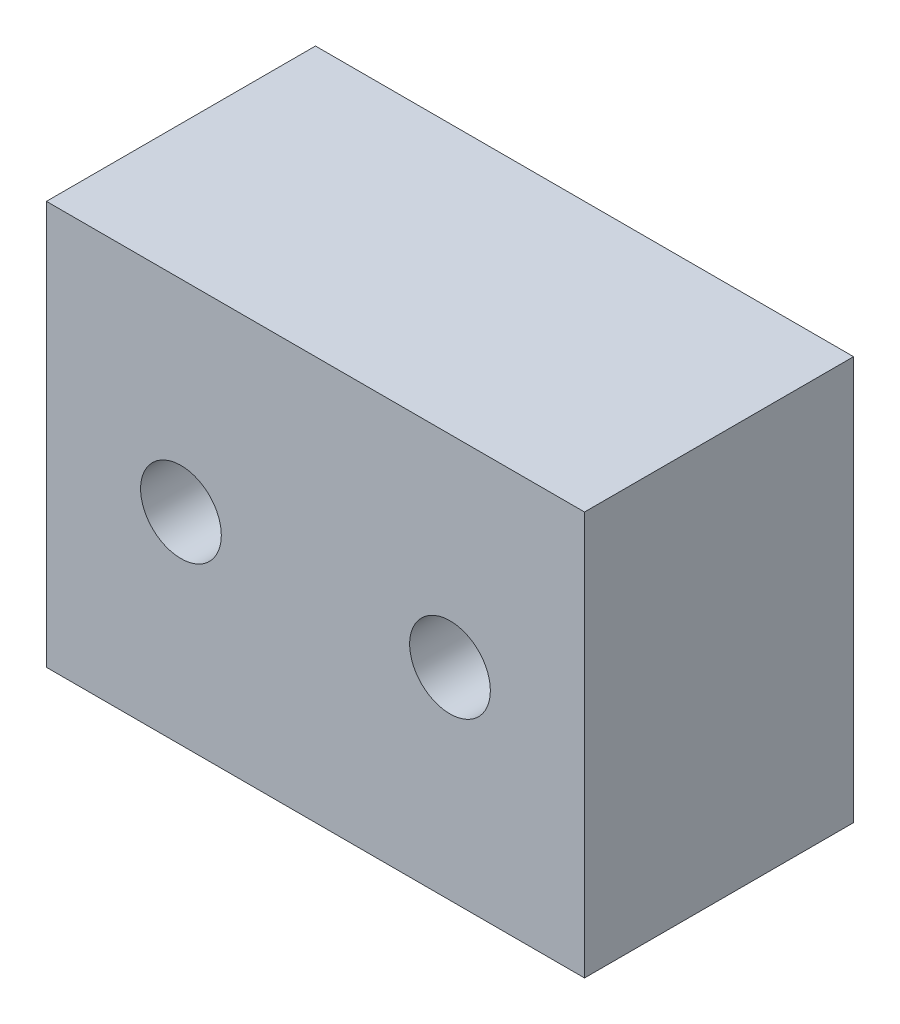
from build123d import *

# Parameters (mm, degrees)
SKETCH_BASE_PROFILE_W   = 40
SKETCH_BASE_PROFILE_H   = 30
FEATURE_BASE_DEPTH      = 20
SKETCH_HOLES_PROFILE_R  = 3
FEATURE_TWO_HOLES_DEPTH = 54.851648071


with BuildPart() as part:
    # sketch:base-profile → feature:base (new body)
    with BuildSketch(Plane.XY):
        with Locations((20, 15)):
            Rectangle(SKETCH_BASE_PROFILE_W, SKETCH_BASE_PROFILE_H)
    extrude(amount=FEATURE_BASE_DEPTH)

    # sketch:holes-profile → feature:two-holes (cut, through all)
    with BuildSketch(Plane.XY.offset(20)):
        with Locations((10, 15)):
            Circle(SKETCH_HOLES_PROFILE_R)
        with Locations((30, 15)):
            Circle(SKETCH_HOLES_PROFILE_R)
    extrude(amount=-FEATURE_TWO_HOLES_DEPTH, mode=Mode.SUBTRACT)


solid = part.part
